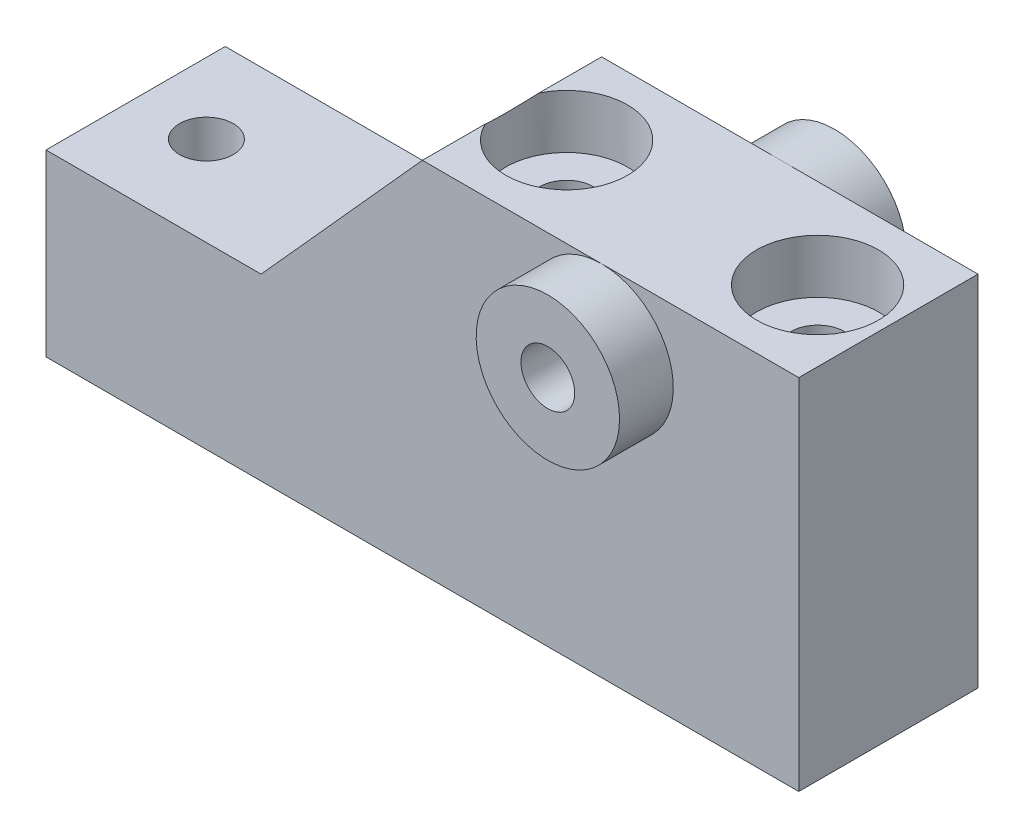
from build123d import *

# Parameters (mm, degrees)
SKETCH_1_R          = 1.5
EXTRUDE_1_DEPTH     = 10
SKETCH_2_R          = 1.5
CUT_EXTRUDE_1_DEPTH = 28
SKETCH_3_R          = 3.4
CUT_EXTRUDE_2_DEPTH = 3
SKETCH_4_R          = 4
SKETCH_4_R_2        = 1.5
EXTRUDE_2_DEPTH     = 3
EXTRUDE_START       = 3
SKETCH_5_R          = 4
SKETCH_5_R_2        = 1.5
EXTRUDE_3_DEPTH     = 3


with BuildPart() as part:
    # 草图1 → 凸台-拉伸1 (new body)
    with BuildSketch(Plane.XY):
        Polygon((0, 0), (42, 0), (42, 20), (21, 20), (12, 10), (0, 10), align=None)
        with Locations((31, 16)):
            Circle(SKETCH_1_R, mode=Mode.SUBTRACT)
    extrude(amount=EXTRUDE_1_DEPTH)

    # 草图2 → 切除-拉伸1 (cut)
    with BuildSketch(Plane.XZ):
        with Locations(Location((38.05, 5, 0), (0, 0, 270))):
            Circle(SKETCH_2_R)
        with Locations(Location((3.95, 5, 0), (0, 0, 270))):
            Circle(SKETCH_2_R)
        with Locations(Location((24.05, 5, 0), (0, 0, 270))):
            Circle(SKETCH_2_R)
    extrude(amount=-CUT_EXTRUDE_1_DEPTH, mode=Mode.SUBTRACT)

    # 草图3 → 切除-拉伸2 (cut)
    with BuildSketch(Plane(origin=(0, 20, 0), x_dir=(1, 0, 0), z_dir=(0, 1, 0))):
        with Locations(Location((24.05, -5, 0), (0, 0, 270))):
            Circle(SKETCH_3_R)
        with Locations(Location((38.05, -5, 0), (0, 0, 270))):
            Circle(SKETCH_3_R)
    extrude(amount=-CUT_EXTRUDE_2_DEPTH, mode=Mode.SUBTRACT)

    # 草图4 → 凸台-拉伸2 (add)
    with BuildSketch(Plane.XY.offset(10)):
        with Locations(Location((31, 16, 0), (0, 0, 90))):
            Circle(SKETCH_4_R)
        with Locations((31, 16)):
            Circle(SKETCH_4_R_2, mode=Mode.SUBTRACT)
    extrude(amount=EXTRUDE_2_DEPTH)

    # 草图5 → 凸台-拉伸3 (add)
    with BuildSketch(Plane(origin=(0, 0, 0), x_dir=(-1, 0, 0), z_dir=(0, 0, -1)).offset(EXTRUDE_START)):
        with Locations(Location((-31, 16, 0), (0, 0, 90))):
            Circle(SKETCH_5_R)
        with Locations((-31, 16)):
            Circle(SKETCH_5_R_2, mode=Mode.SUBTRACT)
    extrude(amount=-EXTRUDE_3_DEPTH)


solid = part.part
